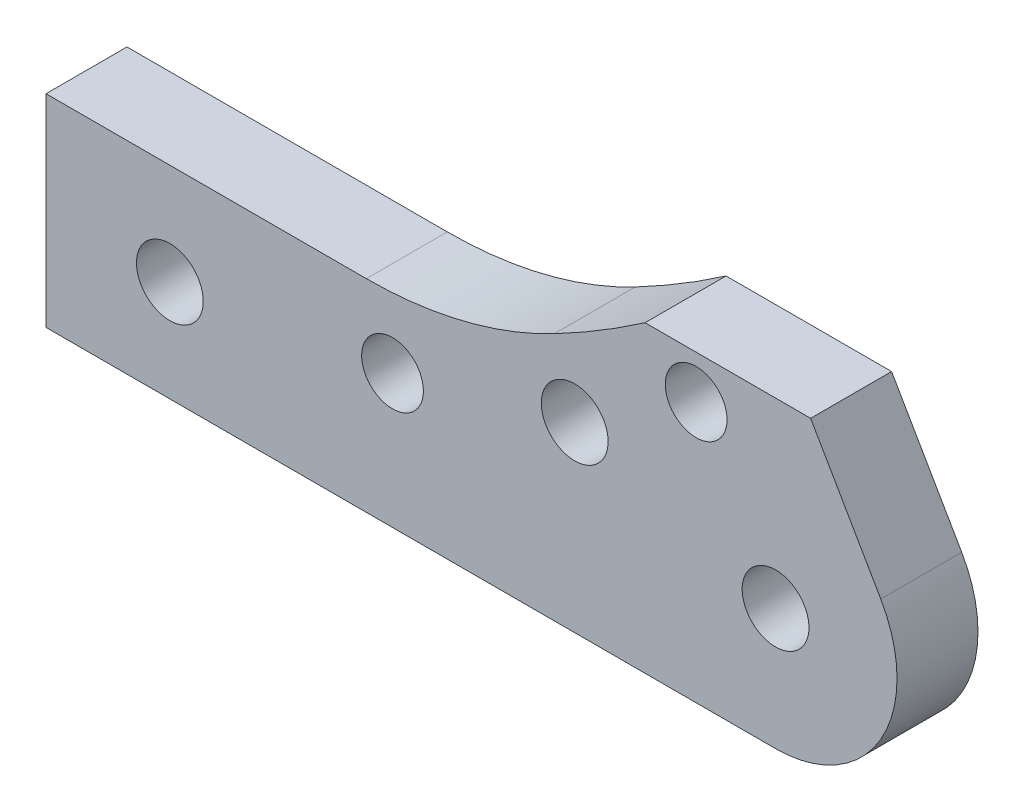
from build123d import *

# Parameters (mm, degrees)
SKETCH_1_R          = 1.65
EXTRUDE_1_DEPTH     = 4
SKETCH_2_W          = 37.773502691
SKETCH_2_H          = 11.965737329
CUT_EXTRUDE_1_DEPTH = 10
SKETCH_4_R          = 1.65
CUT_EXTRUDE_3_DEPTH = 10
CUT_EXTRUDE_2_DEPTH = 10
FILLET_1_R          = 20
SKETCH_5_R          = 1.525
CUT_EXTRUDE_4_DEPTH = 12


with BuildPart() as part:
    # 草图1 → 凸台-拉伸1 (new body)
    with BuildSketch(Plane.XY):
        with BuildLine():
            Line((13.169415516, 42.898917412), (45.169415516, 42.898917412))
            Line((45.169415516, 42.898917412), (54.407019823, 26.898917412))
            ThreePointArc((54.407019823, 26.898917412), (54.407019823, 20.898917412), (49.2108674, 17.898917412))
            Line((49.2108674, 17.898917412), (25.169415516, 17.898917412))
            Line((25.169415516, 17.898917412), (13.169415516, 17.898917412))
            Line((13.169415516, 17.898917412), (13.169415516, 42.898917412))
        make_face()
        with Locations((49.2108674, 23.898917412)):
            Circle(SKETCH_1_R, mode=Mode.SUBTRACT)
    extrude(amount=EXTRUDE_1_DEPTH)

    # 草图2 → 切除-拉伸1 (cut)
    with BuildSketch(Plane.XY.offset(4)):
        with Locations((32.056166862, 38.881786077)):
            Rectangle(SKETCH_2_W, SKETCH_2_H)
    extrude(amount=-CUT_EXTRUDE_1_DEPTH, mode=Mode.SUBTRACT)

    # 草图4 → 切除-拉伸3 (cut)
    with BuildSketch(Plane.XY.offset(4)):
        with Locations((19.287444113, 22.898917412)):
            Circle(SKETCH_4_R)
        with Locations((39.287444113, 26.898917412)):
            Circle(SKETCH_4_R)
    extrude(amount=-CUT_EXTRUDE_3_DEPTH, mode=Mode.SUBTRACT)

    # 草图3 → 切除-拉伸2 (cut)
    with BuildSketch(Plane(origin=(0, 0, 0), x_dir=(-1, 0, 0), z_dir=(0, 0, -1))):
        with BuildLine():
            Line((-13.169415516, 27.898917412), (-33.118062206, 27.898917412))
            ThreePointArc((-33.118062206, 27.898917412), (-38.100309763, 30.092049708), (-42.764440301, 32.898917412))
            Line((-42.764440301, 32.898917412), (-13.169415516, 32.898917412))
            Line((-13.169415516, 32.898917412), (-13.169415516, 27.898917412))
        make_face()
    extrude(amount=-CUT_EXTRUDE_2_DEPTH, mode=Mode.SUBTRACT)

    # 圆角1
    fillet_1_edges = [part.edges().sort_by_distance(p)[0] for p in [
        (33.118062206, 27.898917412, 2),
    ]]
    fillet(fillet_1_edges, radius=FILLET_1_R)

    # 草图5 → 切除-拉伸4 (cut)
    with BuildSketch(Plane.XY.offset(4)):
        with Locations((30.287444113, 24.499597572)):
            Circle(SKETCH_5_R)
        with Locations((45.287444113, 30.764768776)):
            Circle(SKETCH_5_R)
    extrude(amount=-CUT_EXTRUDE_4_DEPTH, mode=Mode.SUBTRACT)


solid = part.part
